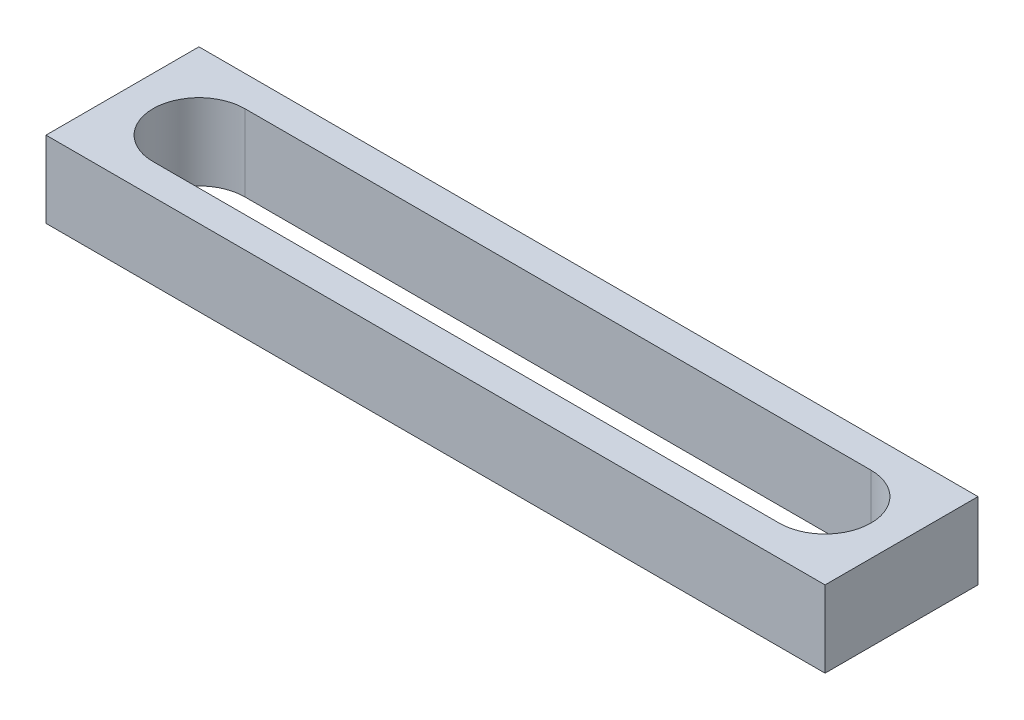
from build123d import *

# Parameters (mm, degrees)
SKETCH1_W           = 50.94
SKETCH1_H           = 10
BOSS_EXTRUDE1_DEPTH = 5
CUT_EXTRUDE1_DEPTH  = 53.152503296


with BuildPart() as part:
    # Sketch1 → Boss-Extrude1 (new body)
    with BuildSketch(Plane(origin=(0, 0, 0), x_dir=(1, 0, 0), z_dir=(0, 1, 0))):
        with Locations((-25.47, 5)):
            Rectangle(SKETCH1_W, SKETCH1_H)
    extrude(amount=BOSS_EXTRUDE1_DEPTH)

    # Sketch2 → Cut-Extrude1 (cut, through all)
    with BuildSketch(Plane(origin=(0, 5, 0), x_dir=(1, 0, 0), z_dir=(0, 1, 0))):
        with BuildLine():
            Line((-45.94, 2), (-5, 2))
            ThreePointArc((-5, 2), (-2, 5), (-5, 8))
            Line((-5, 8), (-45.94, 8))
            ThreePointArc((-45.94, 8), (-48.94, 5), (-45.94, 2))
        make_face()
    extrude(amount=-CUT_EXTRUDE1_DEPTH, mode=Mode.SUBTRACT)


solid = part.part
